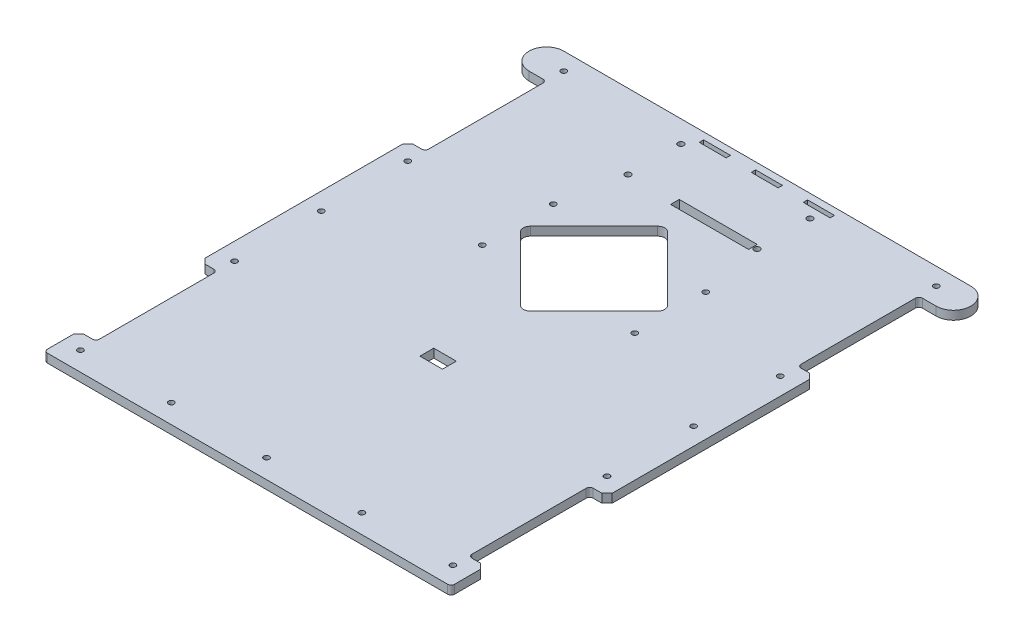
from build123d import *

# Parameters (mm, degrees)
BOSS_EXTRUDE1_DEPTH       = 5
FILLET3_RADIUS            = 10
FILLET3_LENGTH            = 5
FILLET4_RADIUS            = 10
FILLET4_LENGTH            = 5
FILLET2_R                 = 2
LAYER_FIX_HOLE_DEPTH      = 229.869504303
LAYER_FIX_HOLE_DEPTH_BACK = 229.869504303
SKETCH2_R                 = 1.6
SKETCH3_R                 = 1.6
ARM_FIX_HOLE_DEPTH        = 229.869504303
SKETCH4_W                 = 15.5
SKETCH4_H                 = 2.5
IR_FIX_HOLE_DEPTH         = 229.869504303
CHAMFER1_SIZE             = 3
SKETCH5_W                 = 15.5
SKETCH5_H                 = 2.5
BOSS_EXTRUDE2_DEPTH       = 5
TURN_ON_OFF_SWITCH_REACH  = 230.87
SKETCH6_W                 = 13
SKETCH6_H                 = 8
CUT_EXTRUDE2_DEPTH        = 229.869504303
CUT_EXTRUDE2_DEPTH_BACK   = 229.869504303
SKETCH9_R                 = 1.7
SKETCH9_W                 = 45
SKETCH9_H                 = 5


with BuildPart() as part:
    # Sketch1 → Boss-Extrude1 (new body)
    with BuildSketch(Plane(origin=(0, 0, 0), x_dir=(1, 0, 0), z_dir=(0, 1, 0))):
        Polygon((-117.5, -110), (117.5, -110), (117.5, -90), (107.5, -90), (107.5, -20), (117.5, -20), (117.5, 100), (107.5, 100), (107.5, 170), (127.5, 170), (127.5, 190), (-127.5, 190), (-127.5, 170), (-107.5, 170), (-107.5, 100), (-117.5, 100), (-117.5, -20), (-107.5, -20), (-107.5, -90), (-117.5, -90), align=None)
    extrude(amount=BOSS_EXTRUDE1_DEPTH)

    # Fillet3: full round fillet: the end face becomes a half cylinder, R = half its width
    fillet3_face = Plane((127.5, 2.5, -180), x_dir=(0, 1, 0), z_dir=(1, 0, 0))  # on the end face: x along it, z out of the body
    fillet3_slab = fillet3_face.offset(-FILLET3_RADIUS / 2) * Box(FILLET3_LENGTH, 2 * FILLET3_RADIUS, FILLET3_RADIUS, mode=Mode.PRIVATE)  # the body's end, R deep
    fillet3_round = Plane((117.5, 2.5, -180), x_dir=(1, 0, 0), z_dir=(0, 1, 0)) * Cylinder(FILLET3_RADIUS, FILLET3_LENGTH, mode=Mode.PRIVATE)  # its axis R under the face
    add(fillet3_slab - fillet3_round, mode=Mode.SUBTRACT)

    # Fillet4: full round fillet: the end face becomes a half cylinder, R = half its width
    fillet4_face = Plane((-127.5, 2.5, -180), x_dir=(0, 1, 0), z_dir=(-1, 0, 0))  # on the end face: x along it, z out of the body
    fillet4_slab = fillet4_face.offset(-FILLET4_RADIUS / 2) * Box(FILLET4_LENGTH, 2 * FILLET4_RADIUS, FILLET4_RADIUS, mode=Mode.PRIVATE)  # the body's end, R deep
    fillet4_round = Plane((-117.5, 2.5, -180), x_dir=(-1, 0, 0), z_dir=(0, 1, 0)) * Cylinder(FILLET4_RADIUS, FILLET4_LENGTH, mode=Mode.PRIVATE)  # its axis R under the face
    add(fillet4_slab - fillet4_round, mode=Mode.SUBTRACT)

    # Fillet2
    fillet2_edges = [part.edges().sort_by_distance(p)[0] for p in [
        (117.5, 2.5, 110),
        (-117.5, 2.5, 110),
        (-107.5, 2.5, 90),
        (-107.5, 2.5, 20),
        (-107.5, 2.5, -100),
        (-107.5, 2.5, -170),
        (107.5, 2.5, -170),
        (107.5, 2.5, -100),
        (107.5, 2.5, 20),
        (107.5, 2.5, 90),
    ]]
    fillet(fillet2_edges, radius=FILLET2_R)

    # Sketch2 → layer fix hole (cut, two sides: drawn at the far end of the back side and taken through both)
    with BuildSketch(Plane(origin=(0, 5, 0), x_dir=(1, 0, 0), z_dir=(0, 1, 0)).offset(-LAYER_FIX_HOLE_DEPTH_BACK)):
        with Locations(Location((107.5, 180, 0), (0, 0, 270))):
            Circle(SKETCH2_R)
        with Locations(Location((107.5, 40, 0), (0, 0, 270))):
            Circle(SKETCH2_R)
        with Locations(Location((107.5, -99, 0), (0, 0, 270))):
            Circle(SKETCH2_R)
        with Locations(Location((-107.5, 40, 0), (0, 0, 270))):
            Circle(SKETCH2_R)
        with Locations(Location((-107.5, -99, 0), (0, 0, 270))):
            Circle(SKETCH2_R)
        with Locations(Location((-107.5, 180, 0), (0, 0, 270))):
            Circle(SKETCH2_R)
        with Locations(Location((0, -99, 0), (0, 0, 270))):
            Circle(SKETCH2_R)
        with Locations(Location((55, -99, 0), (0, 0, 270))):
            Circle(SKETCH2_R)
        with Locations(Location((-55, -99, 0), (0, 0, 270))):
            Circle(SKETCH2_R)
        with Locations(Location((-107.5, 90, 0), (0, 0, 270))):
            Circle(SKETCH2_R)
        with Locations(Location((107.5, 90, 0), (0, 0, 270))):
            Circle(SKETCH2_R)
        with Locations(Location((-107.5, -10, 0), (0, 0, 270))):
            Circle(SKETCH2_R)
        with Locations(Location((107.5, -10, 0), (0, 0, 270))):
            Circle(SKETCH2_R)
    extrude(amount=LAYER_FIX_HOLE_DEPTH + LAYER_FIX_HOLE_DEPTH_BACK, mode=Mode.SUBTRACT)

    # Sketch3 → arm fix hole (cut, through all)
    with BuildSketch(Plane(origin=(0, 5, 0), x_dir=(1, 0, 0), z_dir=(0, 1, 0))):
        with Locations(Location((44, 110.5, 0), (0, 0, 270))):
            Circle(SKETCH3_R)
        with Locations(Location((44, 69.5, 0), (0, 0, 270))):
            Circle(SKETCH3_R)
        with Locations(Location((-44, 69.5, 0), (0, 0, 270))):
            Circle(SKETCH3_R)
        with Locations(Location((-44, 110.5, 0), (0, 0, 270))):
            Circle(SKETCH3_R)
        with BuildLine():
            Line((-39.597979746, 92.828427125), (-2.828427125, 129.597979746))
            ThreePointArc((-2.828427125, 129.597979746), (0, 130.769552622), (2.828427125, 129.597979746))
            Line((2.828427125, 129.597979746), (39.597979746, 92.828427125))
            ThreePointArc((39.597979746, 92.828427125), (40.769552622, 90), (39.597979746, 87.171572875))
            Line((39.597979746, 87.171572875), (2.828427125, 50.402020254))
            ThreePointArc((2.828427125, 50.402020254), (0, 49.230447378), (-2.828427125, 50.402020254))
            Line((-2.828427125, 50.402020254), (-39.597979746, 87.171572875))
            ThreePointArc((-39.597979746, 87.171572875), (-40.769552622, 90), (-39.597979746, 92.828427125))
        make_face()
    extrude(amount=-ARM_FIX_HOLE_DEPTH, mode=Mode.SUBTRACT)

    # Sketch4 → IR fix hole (cut, through all)
    with BuildSketch(Plane(origin=(0, 5, 0), x_dir=(1, 0, 0), z_dir=(0, 1, 0))):
        with Locations((-25, 184.75)):
            Rectangle(SKETCH4_W, SKETCH4_H)
        with Locations((-65, 184.75)):
            Rectangle(SKETCH4_W, SKETCH4_H)
        with Locations((5, 184.75)):
            Rectangle(SKETCH4_W, SKETCH4_H)
        with Locations((35, 184.75)):
            Rectangle(SKETCH4_W, SKETCH4_H)
    extrude(amount=-IR_FIX_HOLE_DEPTH, mode=Mode.SUBTRACT)

    # Chamfer1
    chamfer1_edges = [part.edges().sort_by_distance(p)[0] for p in [
        (-117.5, 2.5, 90),
        (-117.5, 2.5, 20),
        (-117.5, 2.5, -100),
        (117.5, 2.5, -100),
        (117.5, 2.5, 20),
        (117.5, 2.5, 90),
    ]]
    chamfer(chamfer1_edges, length=CHAMFER1_SIZE)

    # Sketch5 → Boss-Extrude2 (add)
    with BuildSketch(Plane(origin=(0, 5, 0), x_dir=(1, 0, 0), z_dir=(0, 1, 0))):
        with Locations((-65, 184.75)):
            Rectangle(SKETCH5_W, SKETCH5_H)
    extrude(amount=-BOSS_EXTRUDE2_DEPTH)

    # Sketch6 → Turn on_off Switch (cut, up to next)
    with BuildSketch(Plane(origin=(0, 5, 0), x_dir=(1, 0, 0), z_dir=(0, 1, 0)), mode=Mode.PRIVATE) as turn_on_off_switch_sk1:
        Rectangle(SKETCH6_W, SKETCH6_H)
    turn_on_off_switch_tool1 = extrude(turn_on_off_switch_sk1.sketch, amount=-TURN_ON_OFF_SWITCH_REACH, mode=Mode.PRIVATE) & part.part
    add(turn_on_off_switch_tool1.solids().sort_by_distance((0, 5, 0))[0], mode=Mode.SUBTRACT)

    # Sketch9 → Cut-Extrude2 (cut, two sides: drawn at the far end of the back side and taken through both)
    with BuildSketch(Plane(origin=(0, 5, 0), x_dir=(1, 0, 0), z_dir=(0, 1, 0)).offset(-CUT_EXTRUDE2_DEPTH_BACK)):
        with Locations(Location((-37.25, 177.35, 0), (0, 0, 90))):
            Circle(SKETCH9_R)
        with Locations(Location((37.25, 177.35, 0), (0, 0, 270))):
            Circle(SKETCH9_R)
        with Locations(Location((37.25, 146.85, 0), (0, 0, 90))):
            Circle(SKETCH9_R)
        with Locations(Location((-37.25, 146.85, 0), (0, 0, 270))):
            Circle(SKETCH9_R)
        with Locations((12.5, 146.7)):
            Rectangle(SKETCH9_W, SKETCH9_H)
    extrude(amount=CUT_EXTRUDE2_DEPTH + CUT_EXTRUDE2_DEPTH_BACK, mode=Mode.SUBTRACT)


solid = part.part
